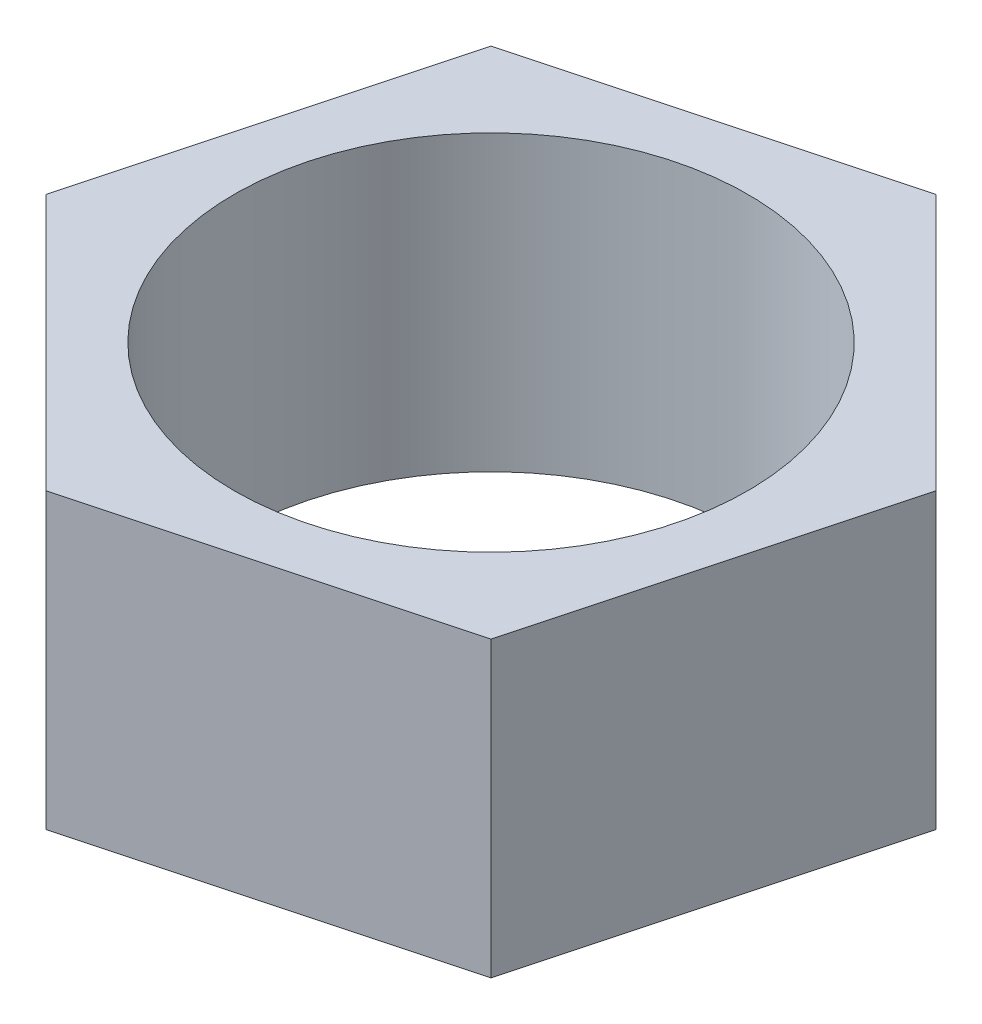
from build123d import *

# Parameters (mm, degrees)
SKETCH1_R           = 3.5
BOSS_EXTRUDE1_DEPTH = 4


with BuildPart() as part:
    # Sketch1 → Boss-Extrude1 (new body)
    with BuildSketch(Plane(origin=(0, 0, 0), x_dir=(1, 0, 0), z_dir=(0, 1, 0))):
        Polygon((3.5, -3.5), (4.781088913, 1.281088913), (1.281088913, 4.781088913), (-3.5, 3.5), (-4.781088913, -1.281088913), (-1.281088913, -4.781088913), align=None)
        Circle(SKETCH1_R, mode=Mode.SUBTRACT)
    extrude(amount=BOSS_EXTRUDE1_DEPTH)


solid = part.part
